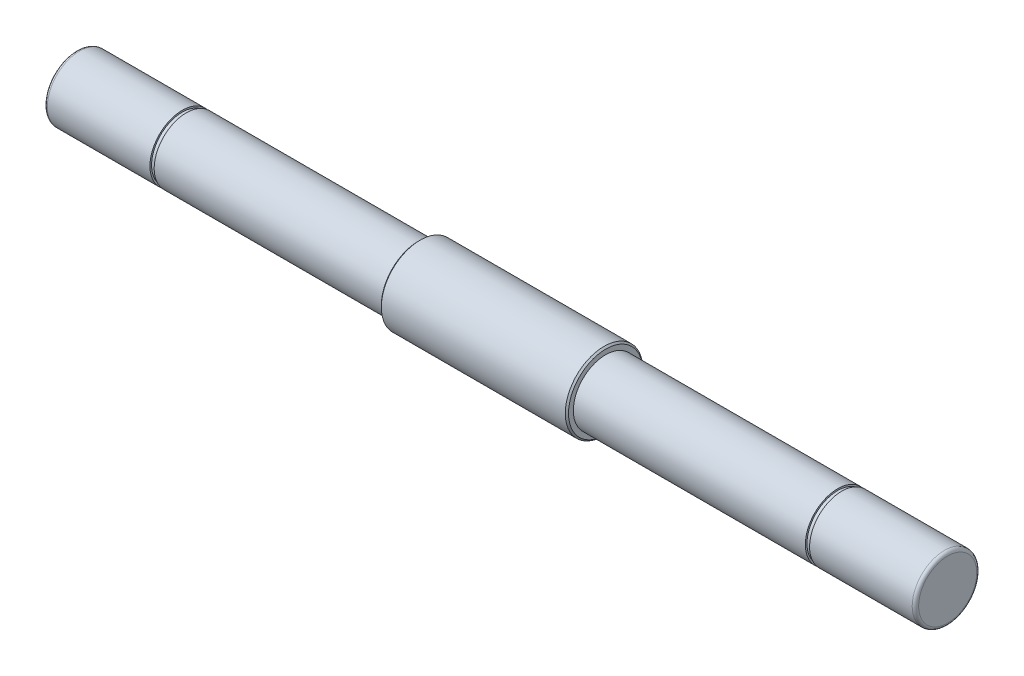
from build123d import *

# Parameters (mm, degrees)
CHAMFER1_SIZE = 0.5
FILLET1_R     = 1


with BuildPart() as part:
    # Sketch1 → Revolve1 (revolve)
    with BuildSketch(Plane(origin=(0, 0, 0), x_dir=(1, 0, 0), z_dir=(0, 1, 0)), mode=Mode.PRIVATE) as revolve1_sk:
        Polygon((-135, 10), (-135, 0), (135, 0), (135, 8), (135, 10), (102.2, 10), (102.2, 9.5), (100.9, 9.5), (100.9, 10), (29, 10), (29, 12), (-29, 12), (-29, 10), (-100.9, 10), (-100.9, 9.5), (-102.2, 9.5), (-102.2, 10), align=None)
    revolve(revolve1_sk.sketch.rotate(Axis((-135, 0, 0), (1, 0, 0)), 180), axis=Axis((-135, 0, 0), (1, 0, 0)))

    # Chamfer1
    chamfer1_edges = [part.edges().sort_by_distance(p)[0] for p in [
        (-29, 0, -12),
        (29, 0, -12),
    ]]
    chamfer(chamfer1_edges, length=CHAMFER1_SIZE)

    # Fillet1
    fillet1_edges = [part.edges().sort_by_distance(p)[0] for p in [
        (-135, 0, -10),
        (135, 0, -10),
    ]]
    fillet(fillet1_edges, radius=FILLET1_R)


solid = part.part
